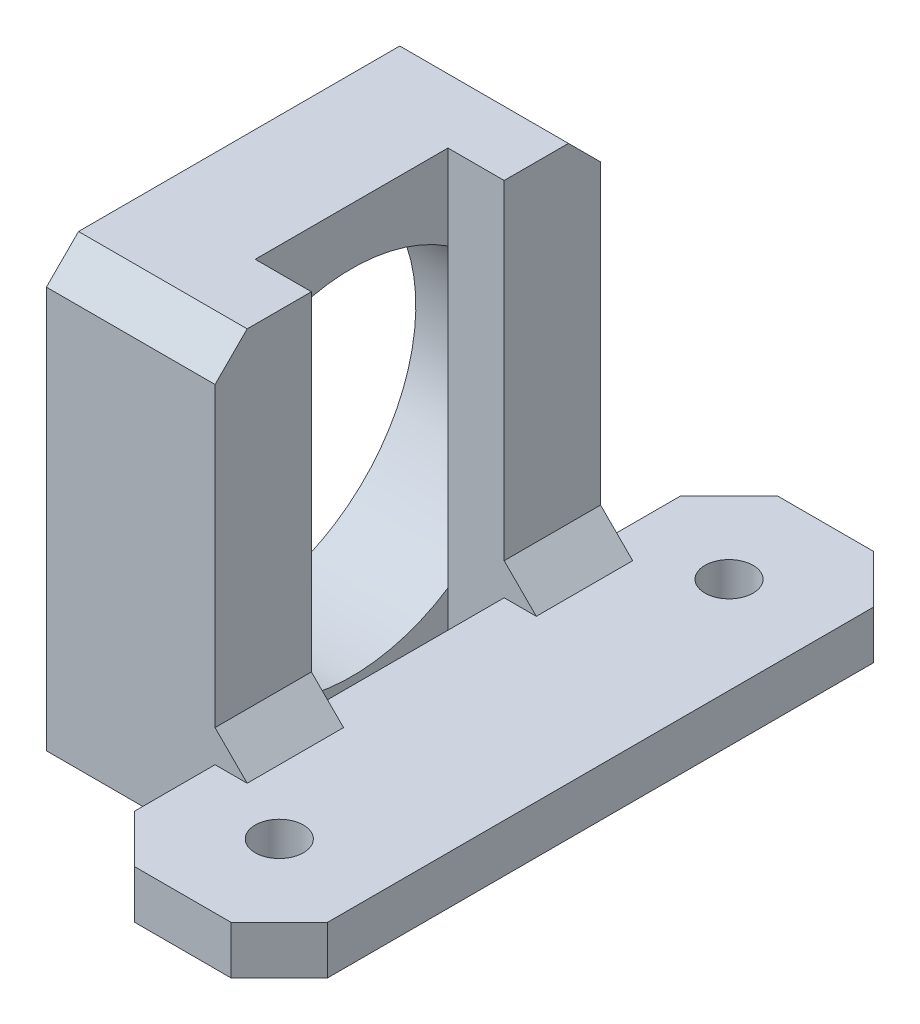
from build123d import *

# Parameters (mm, degrees)
SKETCH1_R           = 1.5
BOSS_EXTRUDE1_DEPTH = 3
BOSS_EXTRUDE2_START = 22.5
SKETCH2_W           = 3.5
SKETCH2_H           = 6
BOSS_EXTRUDE2_DEPTH = 29
CHAMFER2_SIZE       = 2
SKETCH3_W           = 24
SKETCH3_H           = 29
SKETCH3_R           = 11
BOSS_EXTRUDE4_DEPTH = 7
CHAMFER3_SIZE       = 2


with BuildPart() as part:
    # Sketch1 → Boss-Extrude1 (new body)
    with BuildSketch(Plane(origin=(0, 0, 0), x_dir=(1, 0, 0), z_dir=(0, 1, 0))):
        Polygon((-6, 17), (-3, 20), (3, 20), (6, 17), (6, -17), (3, -20), (-3, -20), (-6, -17), align=None)
        with Locations(Location((0, 14, 0), (0, 0, 270))):
            Circle(SKETCH1_R, mode=Mode.SUBTRACT)
        with Locations(Location((0, -14, 0), (0, 0, 270))):
            Circle(SKETCH1_R, mode=Mode.SUBTRACT)
    extrude(amount=BOSS_EXTRUDE1_DEPTH)

    # Sketch2 → Boss-Extrude2 (add)
    with BuildSketch(Plane(origin=(0, 3, 0), x_dir=(1, 0, 0), z_dir=(0, 1, 0)).offset(BOSS_EXTRUDE2_START)):
        with Locations((-7.75, 9)):
            Rectangle(SKETCH2_W, SKETCH2_H)
        with Locations((-7.75, -9)):
            Rectangle(SKETCH2_W, SKETCH2_H)
    extrude(amount=-BOSS_EXTRUDE2_DEPTH)

    # Chamfer2
    chamfer2_edges = [part.edges().sort_by_distance(p)[0] for p in [
        (-6, 0, -9),
        (-6, 0, 9),
        (-6, 3, -9),
        (-6, 3, 9),
    ]]
    chamfer(chamfer2_edges, length=CHAMFER2_SIZE)

    # Sketch3 → Boss-Extrude4 (add)
    with BuildSketch(Plane.ZY.offset(9.5)):
        with Locations((0, 11)):
            Rectangle(SKETCH3_W, SKETCH3_H)
        with Locations(Location((0, 11, 0), (0, 0, 236.944268849))):
            Circle(SKETCH3_R, mode=Mode.SUBTRACT)
    extrude(amount=BOSS_EXTRUDE4_DEPTH)

    # Chamfer3
    chamfer3_edges = [part.edges().sort_by_distance(p)[0] for p in [
        (-11.25, 25.5, -12),
        (-11.25, -3.5, -12),
        (-11.25, -3.5, 12),
        (-11.25, 25.5, 12),
    ]]
    chamfer(chamfer3_edges, length=CHAMFER3_SIZE)


solid = part.part
